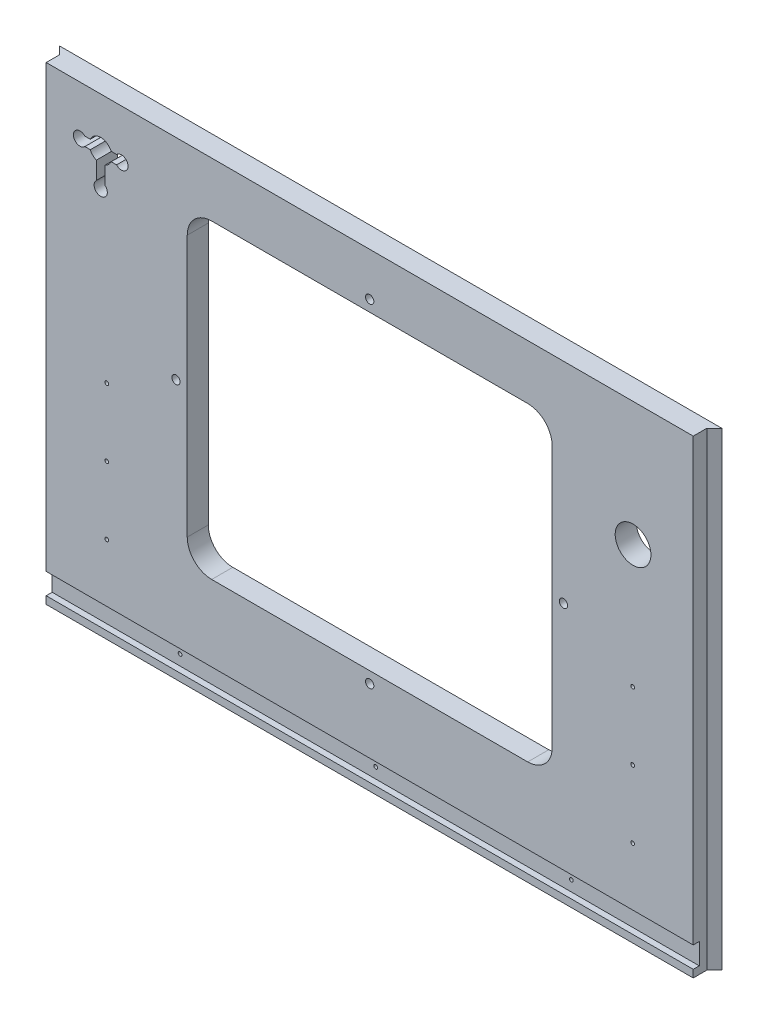
from build123d import *

# Parameters (mm, degrees)
SKETCH2_W          = 558.8
SKETCH2_H          = 396.08125
EXTRUDE1_DEPTH     = 17.78
SKETCH3_R          = 15.08125
SKETCH3_R_2        = 3.4925
SKETCH3_R_3        = 1.5875
SKETCH3_W          = 308.0004
SKETCH3_H          = 261.9629
CUT_EXTRUDE1_DEPTH = 17.78
CUT_EXTRUDE2_DEPTH = 5.08
CUT_EXTRUDE4_DEPTH = 396.08125
FILLET1_R          = 20.6502


with BuildPart() as part:
    # Sketch2 → Extrude1 (new body)
    with BuildSketch(Plane.XY):
        with Locations((11975.041666666, -5854.303125)):
            Rectangle(SKETCH2_W, SKETCH2_H)
    extrude(amount=-EXTRUDE1_DEPTH)

    # Sketch3 → Cut-Extrude1 (cut)
    with BuildSketch(Plane.XY):
        with Locations((12197.291666666, -5761.0375)):
            Circle(SKETCH3_R)
        with Locations((12138.554166666, -5833.26875)):
            Circle(SKETCH3_R_2)
        with Locations((12196.974166666, -5865.01875)):
            Circle(SKETCH3_R_3)
        with Locations((12196.974166666, -5922.16875)):
            Circle(SKETCH3_R_3)
        with Locations((12196.974166666, -5979.31875)):
            Circle(SKETCH3_R_3)
        with Locations((12140.141666666, -6037.10375)):
            Circle(SKETCH3_R_3)
        with Locations((11975.041666666, -6037.10375)):
            Circle(SKETCH3_R_3)
        with Locations((11809.941666666, -6037.10375)):
            Circle(SKETCH3_R_3)
        with Locations((11753.109166666, -5979.31875)):
            Circle(SKETCH3_R_3)
        with Locations((11753.109166666, -5922.16875)):
            Circle(SKETCH3_R_3)
        with Locations((11753.109166666, -5865.01875)):
            Circle(SKETCH3_R_3)
        with Locations((11811.529166666, -5833.26875)):
            Circle(SKETCH3_R_2)
        with Locations((11975.041666666, -5973.7625)):
            Circle(SKETCH3_R_2)
        with Locations((11975.041666666, -5692.775)):
            Circle(SKETCH3_R_2)
        with Locations((11975.041666666, -5833.26875)):
            Rectangle(SKETCH3_W, SKETCH3_H)
        with BuildLine():
            Line((11734.654409808, -5693.754968556), (11739.23011943, -5693.754968556))
            ThreePointArc((11739.23011943, -5693.754968556), (11748.029166666, -5687.976468556), (11756.828213901, -5693.754968556))
            Line((11756.828213901, -5693.754968556), (11761.386355753, -5693.754968556))
            ThreePointArc((11761.386355753, -5693.754968556), (11767.531113043, -5692.357368906), (11771.079666666, -5697.564968556))
            ThreePointArc((11771.079666666, -5697.564968556), (11767.531113043, -5702.772568206), (11761.386355753, -5701.374968556))
            Line((11761.386355753, -5701.374968556), (11756.828213901, -5701.374968556))
            ThreePointArc((11756.828213901, -5701.374968556), (11754.760305425, -5704.393665595), (11751.712166666, -5706.417925308))
            Line((11751.712166666, -5706.417925308), (11751.712166666, -5721.30243896))
            ThreePointArc((11751.712166666, -5721.30243896), (11748.029166666, -5731.092968556), (11744.346166666, -5721.30243896))
            Line((11744.346166666, -5721.30243896), (11744.346166666, -5706.417925308))
            ThreePointArc((11744.346166666, -5706.417925308), (11741.298027907, -5704.393665595), (11739.23011943, -5701.374968556))
            Line((11739.23011943, -5701.374968556), (11734.654409809, -5701.374968556))
            ThreePointArc((11734.654409809, -5701.374968556), (11724.978666666, -5697.564968556), (11734.654409808, -5693.754968556))
        make_face()
    extrude(amount=-CUT_EXTRUDE1_DEPTH, mode=Mode.SUBTRACT)

    # Sketch4 → Cut-Extrude2 (cut)
    with BuildSketch(Plane.XY):
        Polygon((11975.041666666, -6028.21375), (11695.641666666, -6028.21375), (11695.641666666, -6045.99375), (12254.441666666, -6045.99375), (12254.441666666, -6028.21375), align=None)
    extrude(amount=-CUT_EXTRUDE2_DEPTH, mode=Mode.SUBTRACT)

    # Sketch7 → Cut-Extrude4 (cut)
    with BuildSketch(Plane.XZ.offset(6052.34375)):
        Polygon((11701.991666666, -11.43), (11701.991666666, 0), (11695.641666666, 0), (11695.641666666, -17.78), align=None)
        Polygon((12248.091666666, -11.43), (12254.441666666, -17.78), (12254.441666666, 0), (12248.091666666, 0), align=None)
    extrude(amount=-CUT_EXTRUDE4_DEPTH, mode=Mode.SUBTRACT)

    # Fillet1
    fillet1_edges = [part.edges().sort_by_distance(p)[0] for p in [
        (11821.041466666, -5964.2502, -8.89),
        (11821.041466666, -5702.2873, -8.89),
        (12129.041866666, -5702.2873, -8.89),
        (12129.041866666, -5964.2502, -8.89),
    ]]
    fillet(fillet1_edges, radius=FILLET1_R)


solid = part.part
